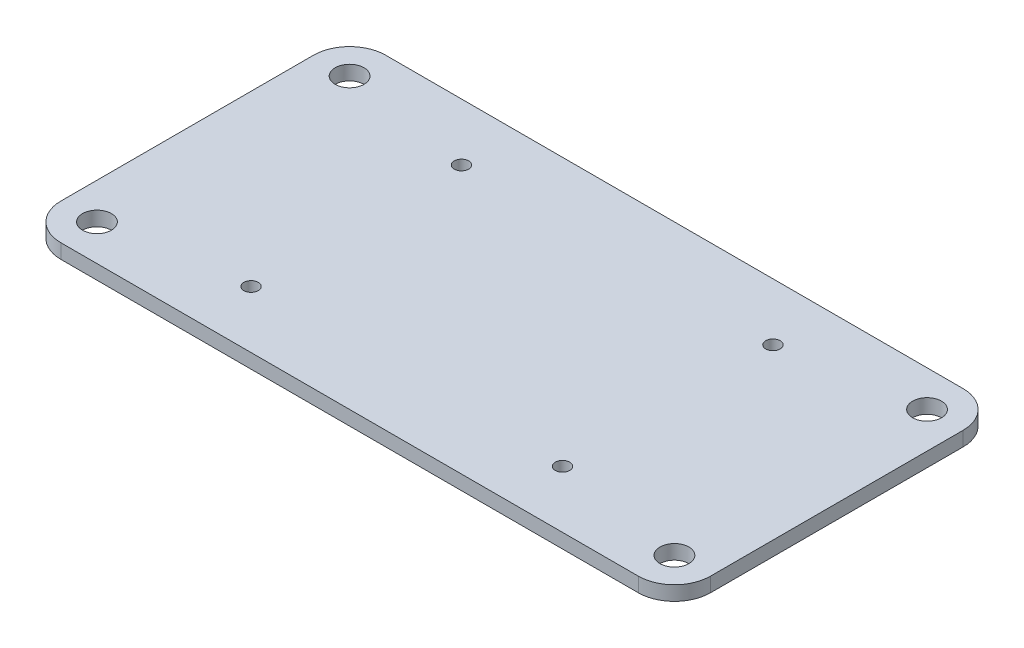
from build123d import *

# Parameters (mm, degrees)
CROQUIS2_W              = 180
CROQUIS2_H              = 90
SALIENTE_EXTRUIR1_DEPTH = 4
REDONDEO1_R             = 10
CORTAR_EXTRUIR2_REACH   = 102.703
CROQUIS4_R              = 4
CORTAR_EXTRUIR3_REACH   = 102.703
CROQUIS5_R              = 2


with BuildPart() as part:
    # Croquis2 → Saliente-Extruir1 (new body)
    with BuildSketch(Plane(origin=(0, 0, 0), x_dir=(1, 0, 0), z_dir=(0, 1, 0))):
        Rectangle(CROQUIS2_W, CROQUIS2_H)
    extrude(amount=SALIENTE_EXTRUIR1_DEPTH)

    # Redondeo1
    redondeo1_edges = [part.edges().sort_by_distance(p)[0] for p in [
        (90, 2, 45),
        (-90, 2, 45),
        (-90, 2, -45),
        (90, 2, -45),
    ]]
    fillet(redondeo1_edges, radius=REDONDEO1_R)

    # Croquis4 → Cortar-Extruir2 (cut, up to next)
    with BuildSketch(Plane(origin=(0, 4, 0), x_dir=(1, 0, 0), z_dir=(0, 1, 0)), mode=Mode.PRIVATE) as cortar_extruir2_sk1:
        with Locations(Location((-80, 35, 0), (0, 0, 270))):
            Circle(CROQUIS4_R)
    cortar_extruir2_tool1 = extrude(cortar_extruir2_sk1.sketch, amount=-CORTAR_EXTRUIR2_REACH, mode=Mode.PRIVATE) & part.part
    # Croquis4 → Cortar-Extruir2 (cut, up to next)
    with BuildSketch(Plane(origin=(0, 4, 0), x_dir=(1, 0, 0), z_dir=(0, 1, 0)), mode=Mode.PRIVATE) as cortar_extruir2_sk2:
        with Locations(Location((-80, -35, 0), (0, 0, 270))):
            Circle(CROQUIS4_R)
    cortar_extruir2_tool2 = extrude(cortar_extruir2_sk2.sketch, amount=-CORTAR_EXTRUIR2_REACH, mode=Mode.PRIVATE) & part.part
    # Croquis4 → Cortar-Extruir2 (cut, up to next)
    with BuildSketch(Plane(origin=(0, 4, 0), x_dir=(1, 0, 0), z_dir=(0, 1, 0)), mode=Mode.PRIVATE) as cortar_extruir2_sk3:
        with Locations(Location((80, -35, 0), (0, 0, 90))):
            Circle(CROQUIS4_R)
    cortar_extruir2_tool3 = extrude(cortar_extruir2_sk3.sketch, amount=-CORTAR_EXTRUIR2_REACH, mode=Mode.PRIVATE) & part.part
    # Croquis4 → Cortar-Extruir2 (cut, up to next)
    with BuildSketch(Plane(origin=(0, 4, 0), x_dir=(1, 0, 0), z_dir=(0, 1, 0)), mode=Mode.PRIVATE) as cortar_extruir2_sk4:
        with Locations(Location((80, 35, 0), (0, 0, 90))):
            Circle(CROQUIS4_R)
    cortar_extruir2_tool4 = extrude(cortar_extruir2_sk4.sketch, amount=-CORTAR_EXTRUIR2_REACH, mode=Mode.PRIVATE) & part.part
    add(cortar_extruir2_tool1.solids().sort_by_distance((-80, 4, -35))[0], mode=Mode.SUBTRACT)
    add(cortar_extruir2_tool2.solids().sort_by_distance((-80, 4, 35))[0], mode=Mode.SUBTRACT)
    add(cortar_extruir2_tool3.solids().sort_by_distance((80, 4, 35))[0], mode=Mode.SUBTRACT)
    add(cortar_extruir2_tool4.solids().sort_by_distance((80, 4, -35))[0], mode=Mode.SUBTRACT)

    # Croquis5 → Cortar-Extruir3 (cut, up to next)
    with BuildSketch(Plane(origin=(0, 4, 0), x_dir=(1, 0, 0), z_dir=(0, 1, 0)), mode=Mode.PRIVATE) as cortar_extruir3_sk1:
        with Locations(Location((-43.15, 29.15, 0), (0, 0, 270))):
            Circle(CROQUIS5_R)
    cortar_extruir3_tool1 = extrude(cortar_extruir3_sk1.sketch, amount=-CORTAR_EXTRUIR3_REACH, mode=Mode.PRIVATE) & part.part
    # Croquis5 → Cortar-Extruir3 (cut, up to next)
    with BuildSketch(Plane(origin=(0, 4, 0), x_dir=(1, 0, 0), z_dir=(0, 1, 0)), mode=Mode.PRIVATE) as cortar_extruir3_sk2:
        with Locations(Location((-43.15, -29.15, 0), (0, 0, 270))):
            Circle(CROQUIS5_R)
    cortar_extruir3_tool2 = extrude(cortar_extruir3_sk2.sketch, amount=-CORTAR_EXTRUIR3_REACH, mode=Mode.PRIVATE) & part.part
    # Croquis5 → Cortar-Extruir3 (cut, up to next)
    with BuildSketch(Plane(origin=(0, 4, 0), x_dir=(1, 0, 0), z_dir=(0, 1, 0)), mode=Mode.PRIVATE) as cortar_extruir3_sk3:
        with Locations(Location((43.15, -29.15, 0), (0, 0, 90))):
            Circle(CROQUIS5_R)
    cortar_extruir3_tool3 = extrude(cortar_extruir3_sk3.sketch, amount=-CORTAR_EXTRUIR3_REACH, mode=Mode.PRIVATE) & part.part
    # Croquis5 → Cortar-Extruir3 (cut, up to next)
    with BuildSketch(Plane(origin=(0, 4, 0), x_dir=(1, 0, 0), z_dir=(0, 1, 0)), mode=Mode.PRIVATE) as cortar_extruir3_sk4:
        with Locations(Location((43.15, 29.15, 0), (0, 0, 90))):
            Circle(CROQUIS5_R)
    cortar_extruir3_tool4 = extrude(cortar_extruir3_sk4.sketch, amount=-CORTAR_EXTRUIR3_REACH, mode=Mode.PRIVATE) & part.part
    add(cortar_extruir3_tool1.solids().sort_by_distance((-43.15, 4, -29.15))[0], mode=Mode.SUBTRACT)
    add(cortar_extruir3_tool2.solids().sort_by_distance((-43.15, 4, 29.15))[0], mode=Mode.SUBTRACT)
    add(cortar_extruir3_tool3.solids().sort_by_distance((43.15, 4, 29.15))[0], mode=Mode.SUBTRACT)
    add(cortar_extruir3_tool4.solids().sort_by_distance((43.15, 4, -29.15))[0], mode=Mode.SUBTRACT)


solid = part.part
